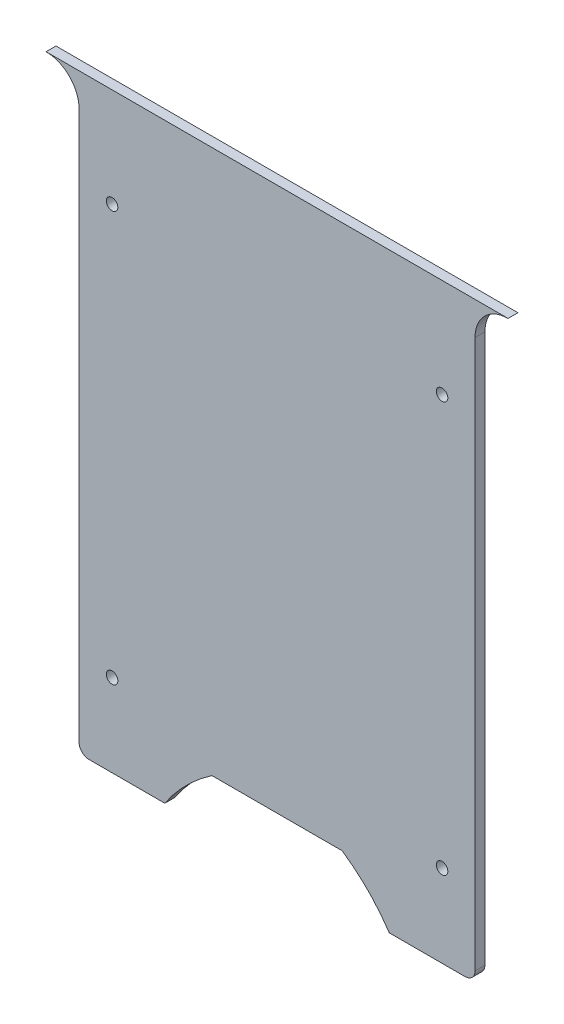
from build123d import *

# Parameters (mm, degrees)
SKETCH1_R           = 1.75
BOSS_EXTRUDE1_DEPTH = 3


with BuildPart() as part:
    # Sketch1 → Boss-Extrude1 (new body)
    with BuildSketch(Plane.XY):
        with BuildLine():
            Line((-70, 219), (70, 219))
            ThreePointArc((70, 219), (62.928932188, 216.071067812), (60, 209))
            Line((60, 209), (60, 42.746292529))
            ThreePointArc((60, 42.746292529), (59.121320344, 40.624972186), (57, 39.746292529))
            Line((57, 39.746292529), (34.010726171, 39.746292529))
            add(Edge.make_bspline(
                [(19.726580418, 54.15), (28.313482158, 48.285383086), (34.010726171, 39.746292529)],
                knots=[0, 0, 0, 1, 1, 1], degree=2))
            Line((19.726580418, 54.15), (-19.726580418, 54.15))
            add(Edge.make_bspline(
                [(-34.01072617, 39.746292529), (-28.313482158, 48.285383086), (-19.726580418, 54.15)],
                knots=[0, 0, 0, 1, 1, 1], degree=2))
            Line((-34.01072617, 39.746292529), (-57, 39.746292529))
            ThreePointArc((-57, 39.746292529), (-59.121320344, 40.624972186), (-60, 42.746292529))
            Line((-60, 42.746292529), (-60, 209))
            ThreePointArc((-60, 209), (-62.928932188, 216.071067812), (-70, 219))
        make_face()
        with Locations((50, 64.746292529)):
            Circle(SKETCH1_R, mode=Mode.SUBTRACT)
        with Locations((50, 189)):
            Circle(SKETCH1_R, mode=Mode.SUBTRACT)
        with Locations((-50, 189)):
            Circle(SKETCH1_R, mode=Mode.SUBTRACT)
        with Locations((-50, 64.746292529)):
            Circle(SKETCH1_R, mode=Mode.SUBTRACT)
    extrude(amount=BOSS_EXTRUDE1_DEPTH)


solid = part.part
